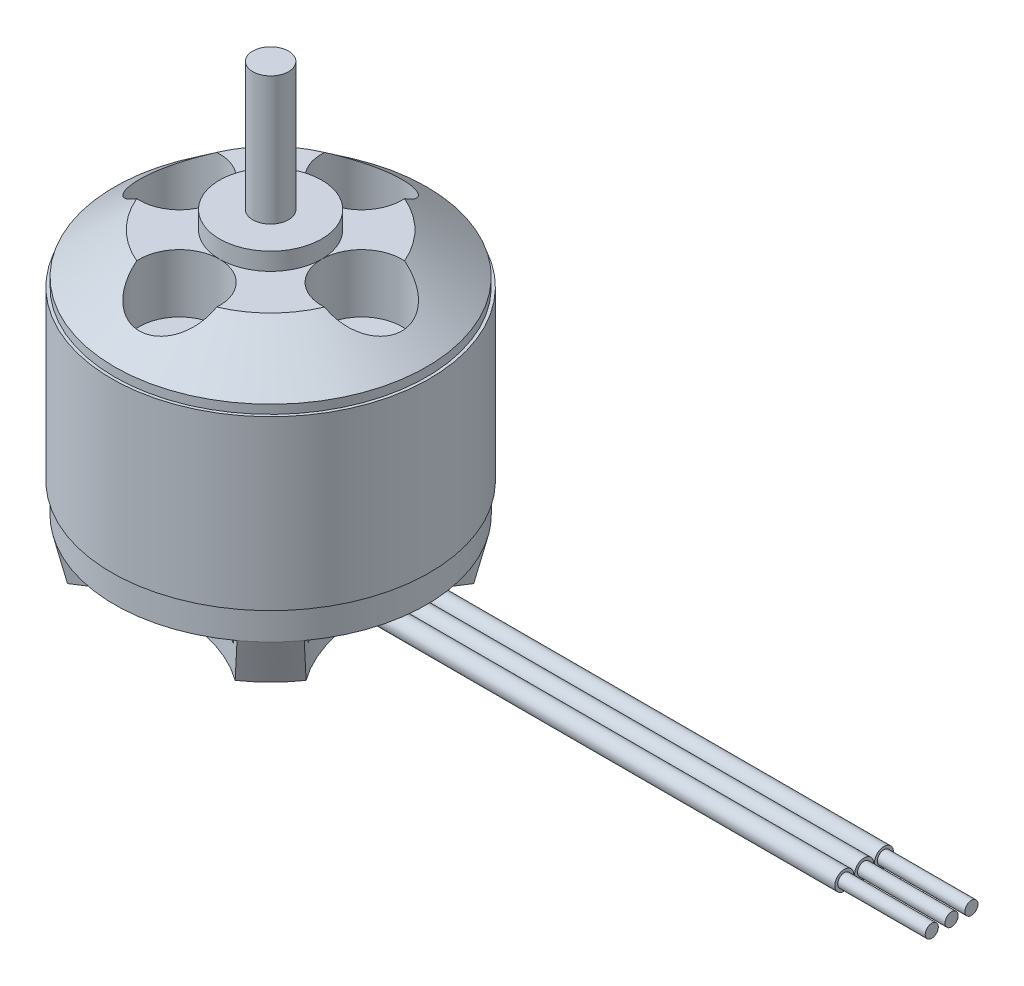
from build123d import *

# Parameters (mm, degrees)
SKETCH2_R               = 3.4925
CUT_EXTRUDE1_DEPTH      = 5.08
SKETCH3_R               = 12.460238567
CUT_EXTRUDE2_DEPTH      = 3.6576
CUT_EXTRUDE3_DEPTH      = 1.27
CUT_EXTRUDE3_DEPTH_BACK = 2.54
SKETCH4_R               = 12.1158
SKETCH10_R              = 0.8255
SKETCH13_R              = 0.5715
BOSS_EXTRUDE1_DEPTH     = 7.62


with BuildPart() as part:
    # Sketch1 → Revolve1 (revolve)
    with BuildSketch(Plane.XY, mode=Mode.PRIVATE) as revolve1_sk:
        Polygon((0, 11.176), (1.55575, 11.176), (1.55575, 0), (4.445, 0), (4.445, -1.524), (8.89, -1.524), (13.589, -5.08), (13.589, -5.842), (13.843, -5.842), (13.843, -20.4724), (13.589, -20.4724), (13.589, -23.0124), (12.7, -26.67), (3.81, -26.67), (3.81, -26.924), (1.55575, -26.924), (1.55575, -28.956), (0, -28.956), align=None)
    revolve(revolve1_sk.sketch.rotate(Axis((0, -28.956, 0), (0, 1, 0)), 90), axis=Axis((0, -28.956, 0), (0, 1, 0)))

    # Sketch2 → Cut-Extrude1 (cut)
    with BuildSketch(Plane(origin=(0, -1.524, 0), x_dir=(1, 0, 0), z_dir=(0, 1, 0))):
        with Locations(Location((0, 7.9375, 0), (0, 0, 270))):
            Circle(SKETCH2_R)
        with Locations(Location((7.9375, 0, 0), (0, 0, 270))):
            Circle(SKETCH2_R)
        with Locations(Location((0, -7.9375, 0), (0, 0, 270))):
            Circle(SKETCH2_R)
        with Locations(Location((-7.9375, 0, 0), (0, 0, 270))):
            Circle(SKETCH2_R)
    extrude(amount=-CUT_EXTRUDE1_DEPTH, mode=Mode.SUBTRACT)

    # Sketch3 → Cut-Extrude2 (cut)
    with BuildSketch(Plane.XZ.offset(26.67)):
        with Locations((0, 20.486638567)):
            Circle(SKETCH3_R)
        with Locations((-20.486638567, 0)):
            Circle(SKETCH3_R)
        with Locations((0, -20.486638567)):
            Circle(SKETCH3_R)
        with Locations((20.486638567, 0)):
            Circle(SKETCH3_R)
    extrude(amount=-CUT_EXTRUDE2_DEPTH, mode=Mode.SUBTRACT)

    # Sketch4 → Cut-Extrude3 (cut, two sides: drawn at the far end of the back side and taken through both)
    with BuildSketch(Plane.XZ.offset(23.0124).offset(-CUT_EXTRUDE3_DEPTH_BACK)):
        with Locations(Location((0, 0, 0), (0, 0, 124.065321666))):
            Circle(SKETCH4_R)
    extrude(amount=CUT_EXTRUDE3_DEPTH + CUT_EXTRUDE3_DEPTH_BACK, mode=Mode.SUBTRACT)


with BuildPart() as body_2:
    # Sweep1: sweep along a path in Sketch12
    with BuildLine(Plane.XY) as sweep1_path:
        Line((0, -21.2979), (3.81, -21.2979))
        ThreePointArc((3.81, -21.2979), (5.388147914, -21.635637579), (6.689842062, -22.589686769))
        ThreePointArc((6.689842062, -22.589686769), (7.991536209, -23.543735959), (9.569684124, -23.881473538))
        Line((9.569684124, -23.881473538), (51.689, -23.881473538))
    # Sketch10 → Sweep1 (sweep)
    with BuildSketch(Plane(origin=(0, 0, 0), x_dir=(0, 0, -1), z_dir=(1, 0, 0))):
        with Locations((0, -21.2979)):
            Circle(SKETCH10_R)
        with Locations((-1.7272, -21.2979)):
            Circle(SKETCH10_R)
        with Locations((1.7272, -21.2979)):
            Circle(SKETCH10_R)
    sweep(path=sweep1_path.line)

    # Sketch13 → Boss-Extrude1 (add)
    with BuildSketch(Plane(origin=(51.689, 0, 0), x_dir=(0, 0, -1), z_dir=(1, 0, 0))):
        with Locations((1.7272, -23.881473538)):
            Circle(SKETCH13_R)
        with Locations((0, -23.881473538)):
            Circle(SKETCH13_R)
        with Locations((-1.7272, -23.881473538)):
            Circle(SKETCH13_R)
    extrude(amount=BOSS_EXTRUDE1_DEPTH)


solid = Compound([part.part, body_2.part])
